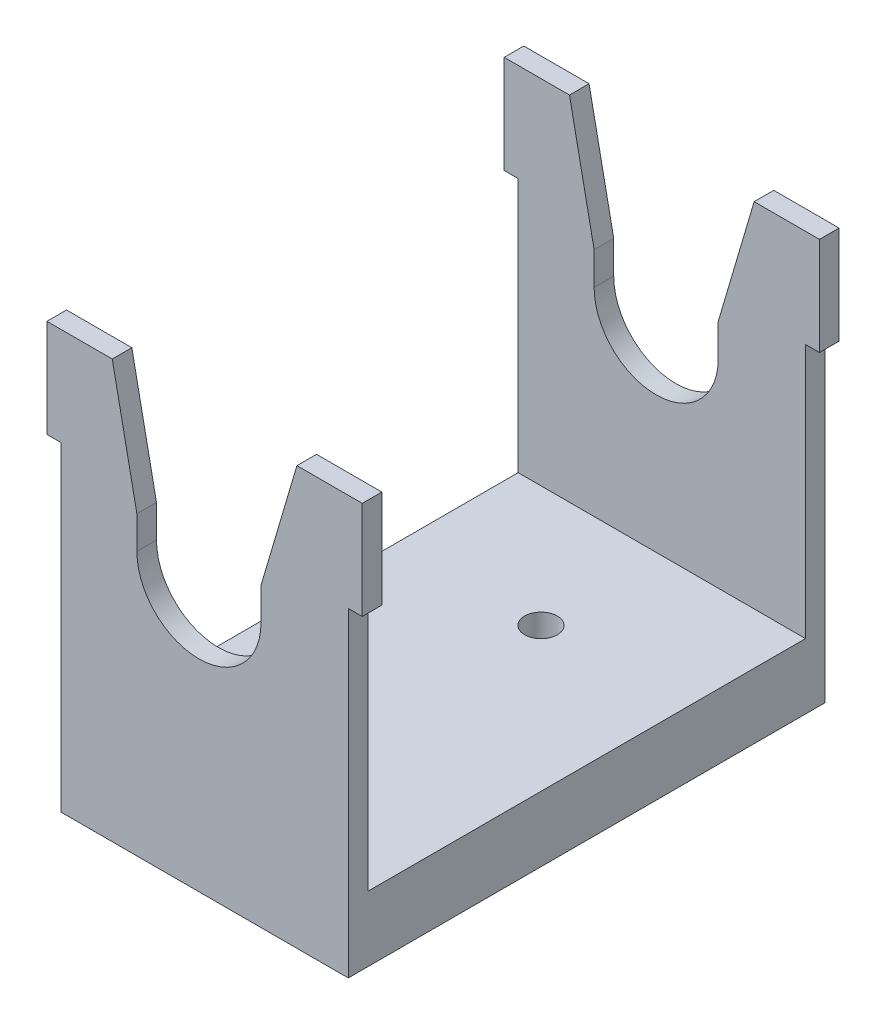
from build123d import *

# Parameters (mm, degrees)
BOSS_EXTRUDE2_DEPTH = 3
SKETCH2_W           = 44
SKETCH2_H           = 70
BOSS_EXTRUDE3_DEPTH = 10
BOSS_EXTRUDE4_DEPTH = 3
CUT_EXTRUDE1_REACH  = 103.047
SKETCH7_R           = 2.5


with BuildPart() as part:
    # Sketch1 → Boss-Extrude2 (new body)
    with BuildSketch(Plane.XY):
        with BuildLine():
            Line((-11.286595542, 0), (32.713404458, 0))
            Line((32.713404458, 0), (32.713404458, 49))
            Line((32.713404458, 49), (34.849610431, 49))
            Line((34.849610431, 49), (34.849610431, 64))
            Line((34.849610431, 64), (24.849610431, 64))
            Line((24.849610431, 64), (19.349610431, 45.378267854))
            Line((19.349610431, 45.378267854), (19.349610431, 40.378267854))
            ThreePointArc((19.349610431, 40.378267854), (9.849610431, 30.878267854), (0.349610431, 40.378267854))
            Line((0.349610431, 40.378267854), (0.349610431, 45.378267854))
            Line((0.349610431, 45.378267854), (-3.422801515, 64))
            Line((-3.422801515, 64), (-13.422801515, 64))
            Line((-13.422801515, 64), (-13.422801515, 49))
            Line((-13.422801515, 49), (-11.286595542, 49))
            Line((-11.286595542, 49), (-11.286595542, 0))
        make_face()
    extrude(amount=BOSS_EXTRUDE2_DEPTH)

    # Sketch2 → Boss-Extrude3 (add)
    with BuildSketch(Plane(origin=(0, 0, 0), x_dir=(1, 0, 0), z_dir=(0, 1, 0))):
        with Locations((10.713404458, 35)):
            Rectangle(SKETCH2_W, SKETCH2_H)
    extrude(amount=BOSS_EXTRUDE3_DEPTH)

    # Sketch4 → Boss-Extrude4 (add)
    with BuildSketch(Plane.XY.offset(-70)):
        with BuildLine():
            Line((34.849610431, 64), (24.849610431, 64))
            Line((24.849610431, 64), (19.349610431, 45.378267854))
            Line((19.349610431, 45.378267854), (19.349610431, 40.378267854))
            ThreePointArc((19.349610431, 40.378267854), (9.849610431, 30.878267854), (0.349610431, 40.378267854))
            Line((0.349610431, 40.378267854), (0.349610431, 45.378267854))
            Line((0.349610431, 45.378267854), (-3.422801515, 64))
            Line((-3.422801515, 64), (-13.422801515, 64))
            Line((-13.422801515, 64), (-13.422801515, 49))
            Line((-13.422801515, 49), (-11.286595542, 49))
            Line((-11.286595542, 49), (-11.286595542, 0))
            Line((-11.286595542, 0), (32.713404458, 0))
            Line((32.713404458, 0), (32.713404458, 49))
            Line((32.713404458, 49), (34.849610431, 49))
            Line((34.849610431, 49), (34.849610431, 64))
        make_face()
    extrude(amount=BOSS_EXTRUDE4_DEPTH)

    # Sketch7 → Cut-Extrude1 (cut, up to next)
    with BuildSketch(Plane(origin=(0, 0, 0), x_dir=(1, 0, 0), z_dir=(0, 1, 0)), mode=Mode.PRIVATE) as cut_extrude1_sk1:
        with Locations(Location((10.713404458, 48.5, 0), (0, 0, 270))):
            Circle(SKETCH7_R)
    cut_extrude1_tool1 = extrude(cut_extrude1_sk1.sketch, amount=CUT_EXTRUDE1_REACH, mode=Mode.PRIVATE) & part.part
    # Sketch7 → Cut-Extrude1 (cut, up to next)
    with BuildSketch(Plane(origin=(0, 0, 0), x_dir=(1, 0, 0), z_dir=(0, 1, 0)), mode=Mode.PRIVATE) as cut_extrude1_sk2:
        with Locations(Location((10.713404458, 18.5, 0), (0, 0, 270))):
            Circle(SKETCH7_R)
    cut_extrude1_tool2 = extrude(cut_extrude1_sk2.sketch, amount=CUT_EXTRUDE1_REACH, mode=Mode.PRIVATE) & part.part
    add(cut_extrude1_tool1.solids().sort_by_distance((10.713404, 0, -48.5))[0], mode=Mode.SUBTRACT)
    add(cut_extrude1_tool2.solids().sort_by_distance((10.713404, 0, -18.5))[0], mode=Mode.SUBTRACT)


solid = part.part
